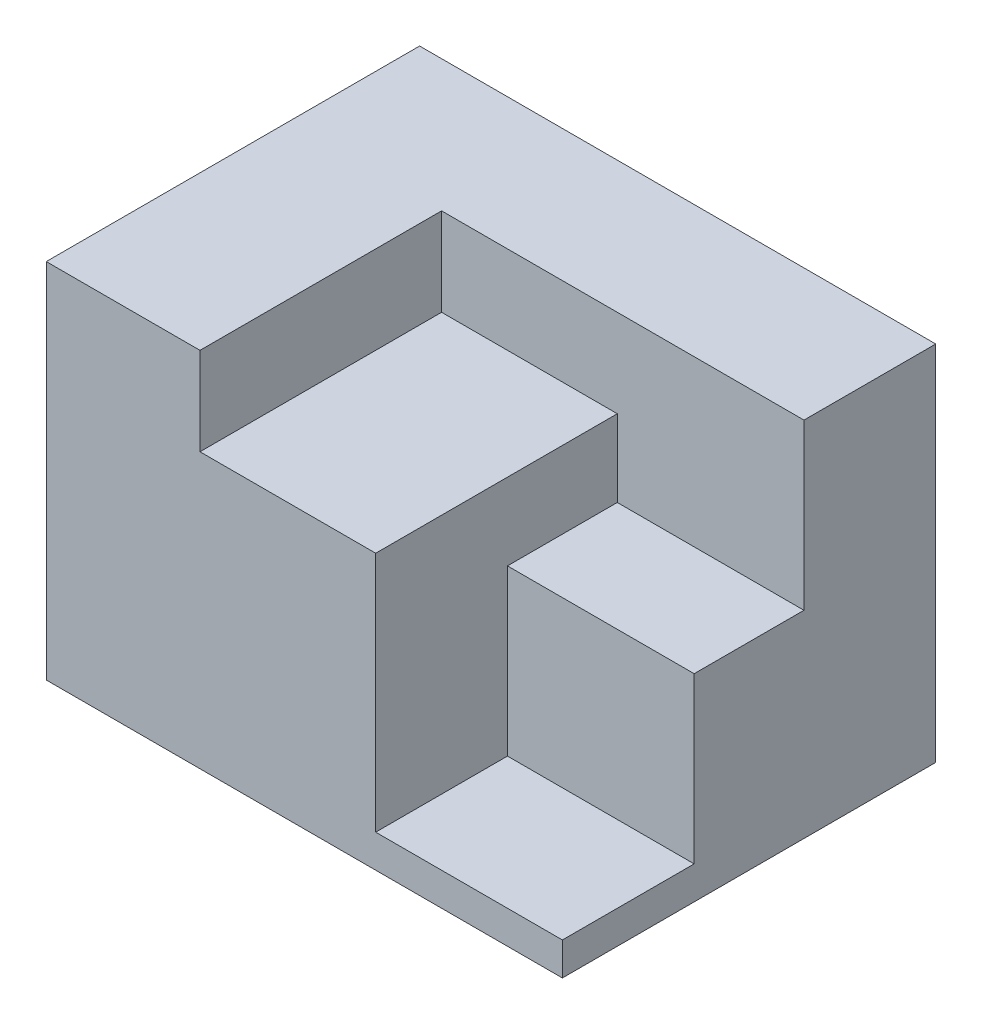
from build123d import *

# Parameters (mm, degrees)
SKETCH1_W           = 47
SKETCH1_H           = 33
BOSS_EXTRUDE1_DEPTH = 34
SKETCH2_W           = 33
SKETCH2_H           = 8
CUT_EXTRUDE1_DEPTH  = 22
SKETCH3_W           = 12
SKETCH3_H           = 15
CUT_EXTRUDE2_DEPTH  = 17


with BuildPart() as part:
    # Sketch1 → Boss-Extrude1 (new body)
    with BuildSketch(Plane.XY):
        with Locations((2.68144213, 1.197180866)):
            Rectangle(SKETCH1_W, SKETCH1_H)
    extrude(amount=BOSS_EXTRUDE1_DEPTH)

    # Sketch2 → Cut-Extrude1 (cut)
    with BuildSketch(Plane.XY.offset(34)):
        with Locations((9.68144213, 13.697180866)):
            Rectangle(SKETCH2_W, SKETCH2_H)
    extrude(amount=-CUT_EXTRUDE1_DEPTH, mode=Mode.SUBTRACT)

    # Sketch3 → Cut-Extrude2 (cut)
    with BuildSketch(Plane(origin=(26.18144213, 0, 0), x_dir=(0, 0, -1), z_dir=(1, 0, 0))):
        with Locations((-28, -4.802819134)):
            Rectangle(SKETCH3_W, SKETCH3_H)
        Polygon((-12, 2.697180866), (-12, 9.697180866), (-34, 9.697180866), (-34, 2.697180866), (-22, 2.697180866), align=None)
    extrude(amount=-CUT_EXTRUDE2_DEPTH, mode=Mode.SUBTRACT)


solid = part.part
